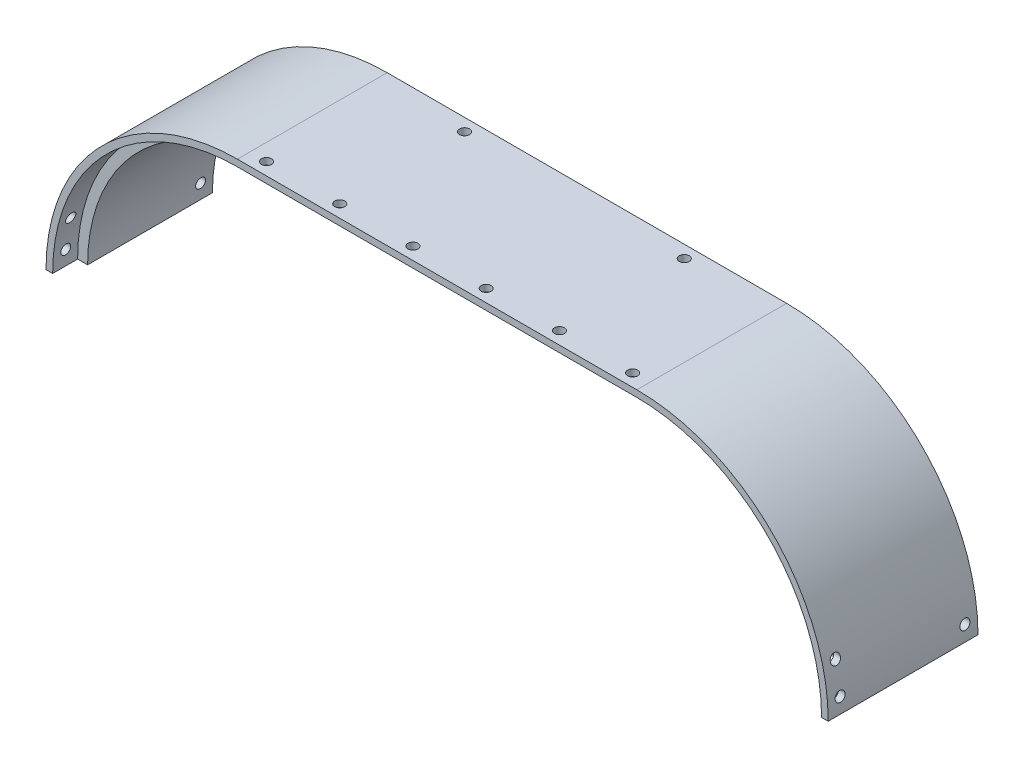
from build123d import *

# Parameters (mm, degrees)
BOSS_EXTRUDE1_DEPTH     = 45
CUT_EXTRUDE1_DEPTH      = 7.5
SKETCH4_R               = 1.5
CUT_EXTRUDE2_DEPTH      = 7.5
CUT_EXTRUDE3_DEPTH      = 139.338353323
CUT_EXTRUDE3_DEPTH_BACK = 139.338353323
SKETCH5_R               = 1.5


with BuildPart() as part:
    # Sketch1 → Boss-Extrude1 (new body)
    with BuildSketch(Plane.XY):
        with BuildLine():
            ThreePointArc((-112.5, 0), (-97.123106012, 37.123106012), (-60, 52.5))
            Line((-60, 52.5), (60, 52.5))
            ThreePointArc((60, 52.5), (97.123106012, 37.123106012), (112.5, 0))
            Line((112.5, 0), (117.5, 0))
            ThreePointArc((117.5, 0), (100.658639918, 40.658639918), (60, 57.5))
            Line((60, 57.5), (-60, 57.5))
            ThreePointArc((-60, 57.5), (-100.658639918, 40.658639918), (-117.5, 0))
            Line((-117.5, 0), (-112.5, 0))
        make_face()
    extrude(amount=BOSS_EXTRUDE1_DEPTH)

    # Sketch3 → Cut-Extrude1 (cut)
    with BuildSketch(Plane.XY.offset(45)):
        with BuildLine():
            Line((-115.5, 0), (115.5, 0))
            ThreePointArc((115.5, 0), (99.244426356, 39.244426356), (60, 55.5))
            Line((60, 55.5), (-60, 55.5))
            ThreePointArc((-60, 55.5), (-99.244426356, 39.244426356), (-115.5, 0))
        make_face()
    extrude(amount=-CUT_EXTRUDE1_DEPTH, mode=Mode.SUBTRACT)

    # Sketch4 → Cut-Extrude2 (cut)
    with BuildSketch(Plane(origin=(0, 57.5, 0), x_dir=(1, 0, 0), z_dir=(0, 1, 0))):
        with Locations(Location((33, -3.75, 0), (0, 0, 270))):
            Circle(SKETCH4_R)
        with Locations(Location((11, -41.25, 0), (0, 0, 270))):
            Circle(SKETCH4_R)
        with Locations(Location((33, -41.25, 0), (0, 0, 270))):
            Circle(SKETCH4_R)
        with Locations(Location((55, -41.25, 0), (0, 0, 270))):
            Circle(SKETCH4_R)
        with Locations(Location((-33, -3.75, 0), (0, 0, 180))):
            Circle(SKETCH4_R)
        with Locations(Location((-11, -41.25, 0), (0, 0, 180))):
            Circle(SKETCH4_R)
        with Locations(Location((-33, -41.25, 0), (0, 0, 180))):
            Circle(SKETCH4_R)
        with Locations(Location((-55, -41.25, 0), (0, 0, 180))):
            Circle(SKETCH4_R)
    extrude(amount=-CUT_EXTRUDE2_DEPTH, mode=Mode.SUBTRACT)

    # Sketch5 → Cut-Extrude3 (cut, two sides: drawn at the far end of the back side and taken through both)
    with BuildSketch(Plane(origin=(0, 0, 0), x_dir=(0, 0, -1), z_dir=(1, 0, 0)).offset(-CUT_EXTRUDE3_DEPTH_BACK)):
        with Locations((-3.75, 4.5)):
            Circle(SKETCH5_R)
        with Locations((-41.25, 4.5)):
            Circle(SKETCH5_R)
        with Locations((-41.25, 13.5)):
            Circle(SKETCH5_R)
    extrude(amount=CUT_EXTRUDE3_DEPTH + CUT_EXTRUDE3_DEPTH_BACK, mode=Mode.SUBTRACT)


solid = part.part
